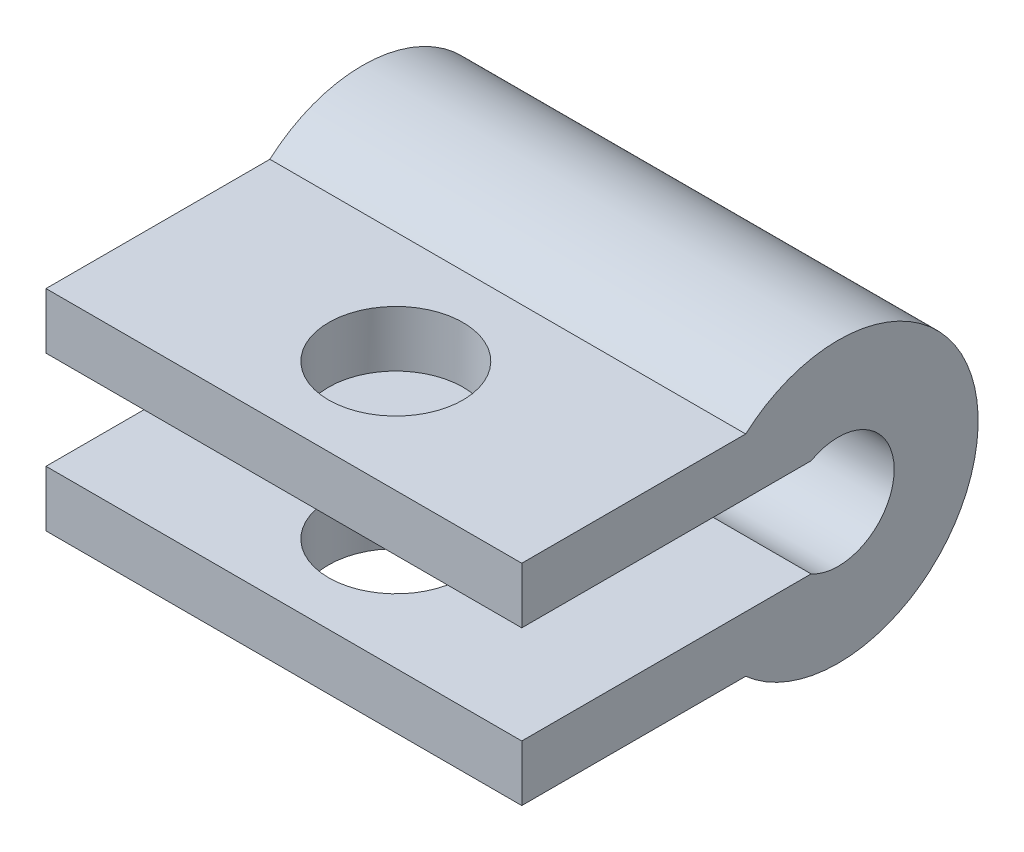
from build123d import *

# Parameters (mm, degrees)
BOSS_EXTRU_1_DEPTH      = 8.5
BOSS_EXTRU_1_DEPTH_BACK = 8.5
D_GAGEMENT_M41_D        = 4.8


with BuildPart() as part:
    # Esquisse1 → Boss.-Extru.1 (new, two sides: drawn at the far end of the back side and taken through both)
    with BuildSketch(Plane(origin=(0, 0, 0), x_dir=(0, 0, -1), z_dir=(1, 0, 0)).offset(-BOSS_EXTRU_1_DEPTH_BACK)):
        with BuildLine():
            Line((-3.307189139, 3.75), (-11.307189139, 3.75))
            Line((-11.307189139, 3.75), (-11.307189139, 1.75))
            Line((-11.307189139, 1.75), (-0.968245837, 1.75))
            ThreePointArc((-0.968245837, 1.75), (2, 0), (-0.968245837, -1.75))
            Line((-0.968245837, -1.75), (-11.307189139, -1.75))
            Line((-11.307189139, -1.75), (-11.307189139, -3.75))
            Line((-11.307189139, -3.75), (-3.307189139, -3.75))
            ThreePointArc((-3.307189139, -3.75), (5, 0), (-3.307189139, 3.75))
        make_face()
    extrude(amount=BOSS_EXTRU_1_DEPTH + BOSS_EXTRU_1_DEPTH_BACK)

    # Dégagement M41 (through all)
    with Locations(Plane(origin=(0, 3.75, 0), x_dir=(1, 0, 0), z_dir=(0, 1, 0))):
        with Locations((0, -7.307189139)):
            Hole(D_GAGEMENT_M41_D / 2)


solid = part.part
